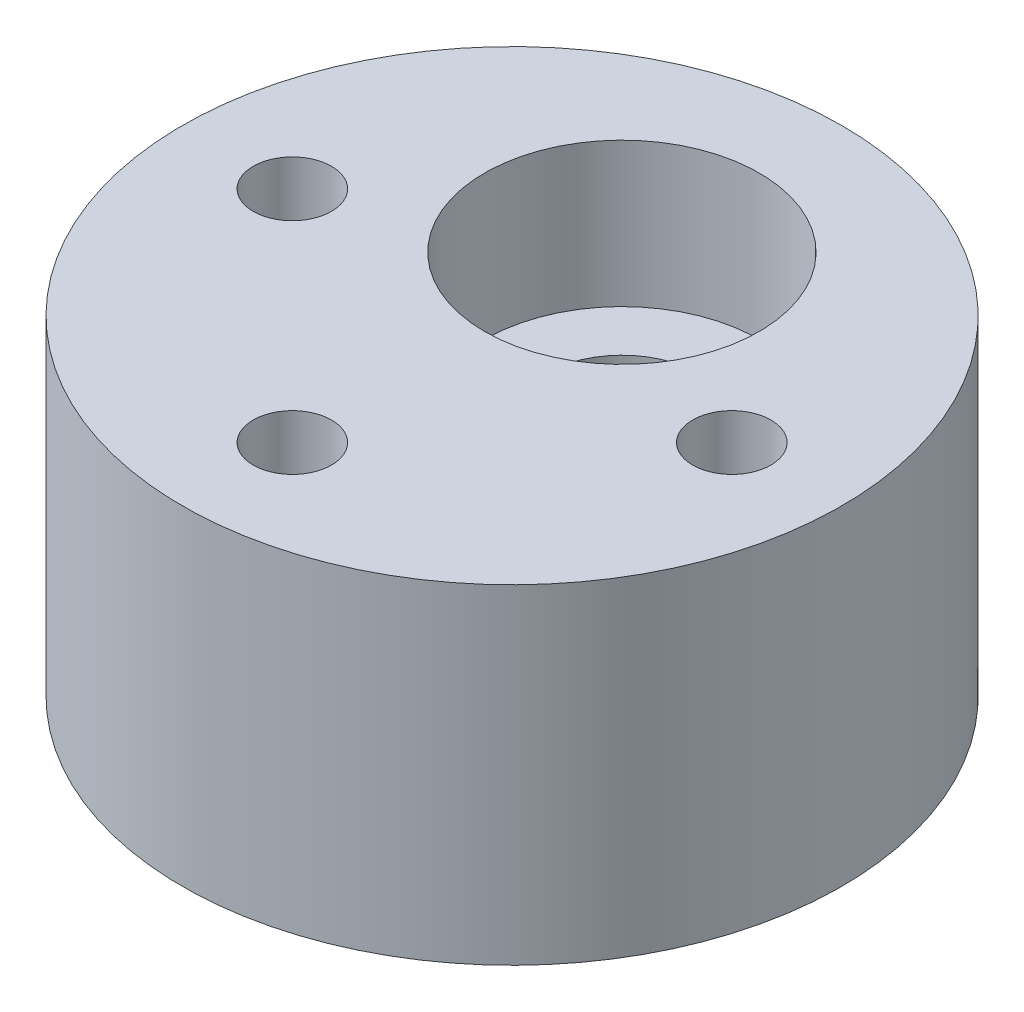
from build123d import *

# Parameters (mm, degrees)
SKETCH1_R                                      = 9.525
BOSS_EXTRUDE1_DEPTH                            = 9.525
CBORE_FOR_8_SOCKET_HEAD_CAP_SCREW1_D           = 4.4958
CBORE_FOR_8_SOCKET_HEAD_CAP_SCREW1_CBORE_D     = 7.9375
CBORE_FOR_8_SOCKET_HEAD_CAP_SCREW1_CBORE_DEPTH = 4.1656
F_1_16_0_0625_DIAMETER_HOLE1_D                 = 1.5875
F_1_16_0_0625_DIAMETER_HOLE1_DEPTH             = 4.826
F_1_16_0_0625_DIAMETER_HOLE1_TIP               = 0.476933116
F_4_40_TAPPED_HOLE1_D                          = 2.2606
F_4_40_TAPPED_HOLE1_DEPTH                      = 6.35
F_4_40_TAPPED_HOLE1_TIP                        = 0.679152758


with BuildPart() as part:
    # Sketch1 → Boss-Extrude1 (new body)
    with BuildSketch(Plane(origin=(0, 0, 0), x_dir=(1, 0, 0), z_dir=(0, 1, 0))):
        with Locations(Location((0, 0, 0), (0, 0, 90))):
            Circle(SKETCH1_R)
    extrude(amount=BOSS_EXTRUDE1_DEPTH)

    # CBORE for #8 Socket Head Cap Screw1 (through all)
    with Locations(Plane(origin=(0, 9.525, 0), x_dir=(1, 0, 0), z_dir=(0, 1, 0))):
        with Locations((0, 3.175)):
            CounterBoreHole(CBORE_FOR_8_SOCKET_HEAD_CAP_SCREW1_D / 2, CBORE_FOR_8_SOCKET_HEAD_CAP_SCREW1_CBORE_D / 2, CBORE_FOR_8_SOCKET_HEAD_CAP_SCREW1_CBORE_DEPTH)

    # 1/16 (0.0625) Diameter Hole1
    with Locations(Plane(origin=(0, 0, 0.381), x_dir=(0, 0, -1), z_dir=(0, -1, 0))):
        with Locations((0, 0)):
            Hole(F_1_16_0_0625_DIAMETER_HOLE1_D / 2, depth=F_1_16_0_0625_DIAMETER_HOLE1_DEPTH)
            with Locations((0, 0, -(F_1_16_0_0625_DIAMETER_HOLE1_DEPTH + F_1_16_0_0625_DIAMETER_HOLE1_TIP / 2))):  # 118° drill point
                Cone(0, F_1_16_0_0625_DIAMETER_HOLE1_D / 2, F_1_16_0_0625_DIAMETER_HOLE1_TIP, mode=Mode.SUBTRACT)

    # #4-40 Tapped Hole1
    with Locations(Plane(origin=(-6.35, 9.525, 0), x_dir=(0, 0, 1), z_dir=(0, 1, 0))):
        with Locations((0, 0), (0, 12.7), (6.35, 6.35)):
            Hole(F_4_40_TAPPED_HOLE1_D / 2, depth=F_4_40_TAPPED_HOLE1_DEPTH)
            with Locations((0, 0, -(F_4_40_TAPPED_HOLE1_DEPTH + F_4_40_TAPPED_HOLE1_TIP / 2))):  # 118° drill point
                Cone(0, F_4_40_TAPPED_HOLE1_D / 2, F_4_40_TAPPED_HOLE1_TIP, mode=Mode.SUBTRACT)


solid = part.part
